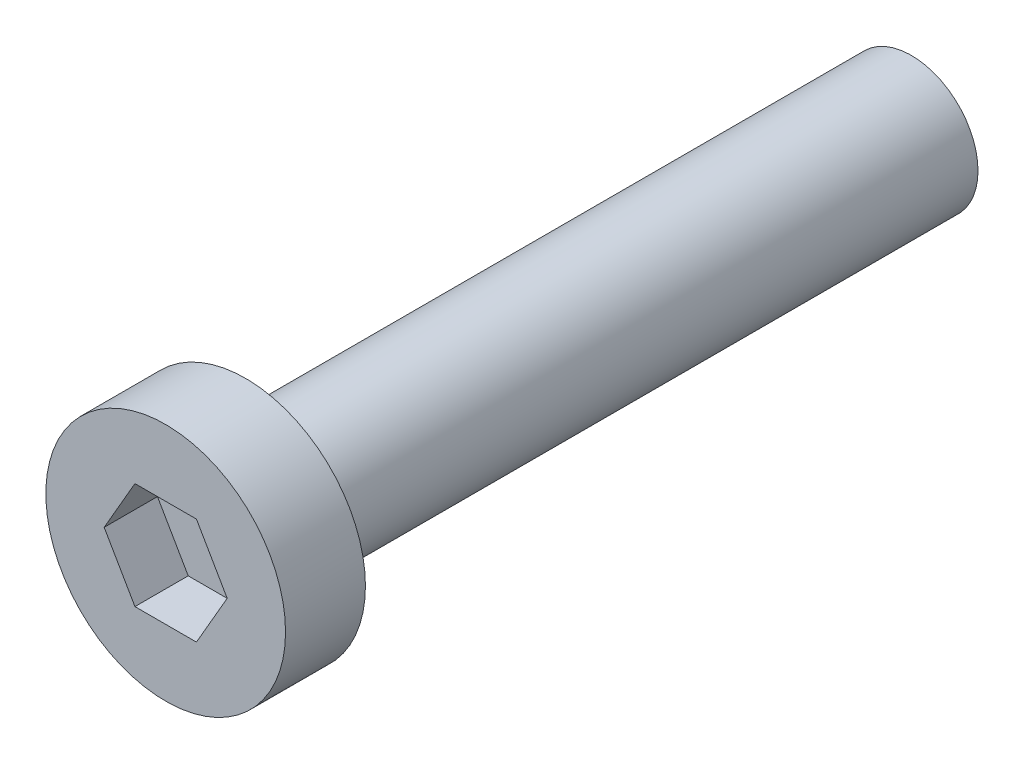
from build123d import *

# Parameters (mm, degrees)
SKETCH_1_R          = 5
EXTRUDE_1_DEPTH     = 50
SKETCH_2_R          = 9
EXTRUDE_2_DEPTH     = 6
CUT_EXTRUDE_1_DEPTH = 4
FILLET_1_R          = 0.5


with BuildPart() as part:
    # 草图1 → 凸台-拉伸1 (new body)
    with BuildSketch(Plane.XY):
        Circle(SKETCH_1_R)
    extrude(amount=EXTRUDE_1_DEPTH)

    # 草图2 → 凸台-拉伸2 (add)
    with BuildSketch(Plane.XY.offset(50)):
        Circle(SKETCH_2_R)
    extrude(amount=EXTRUDE_2_DEPTH)

    # 草图3 → 切除-拉伸1 (cut)
    with BuildSketch(Plane.XY.offset(56)):
        Polygon((4.618802154, 0), (2.309401077, 4), (-2.309401077, 4), (-4.618802154, 0), (-2.309401077, -4), (2.309401077, -4), align=None)
    extrude(amount=-CUT_EXTRUDE_1_DEPTH, mode=Mode.SUBTRACT)

    # 圆角1
    fillet_1_edges = [part.edges().sort_by_distance(p)[0] for p in [
        (-5, 0, 50),
    ]]
    fillet(fillet_1_edges, radius=FILLET_1_R)


solid = part.part
